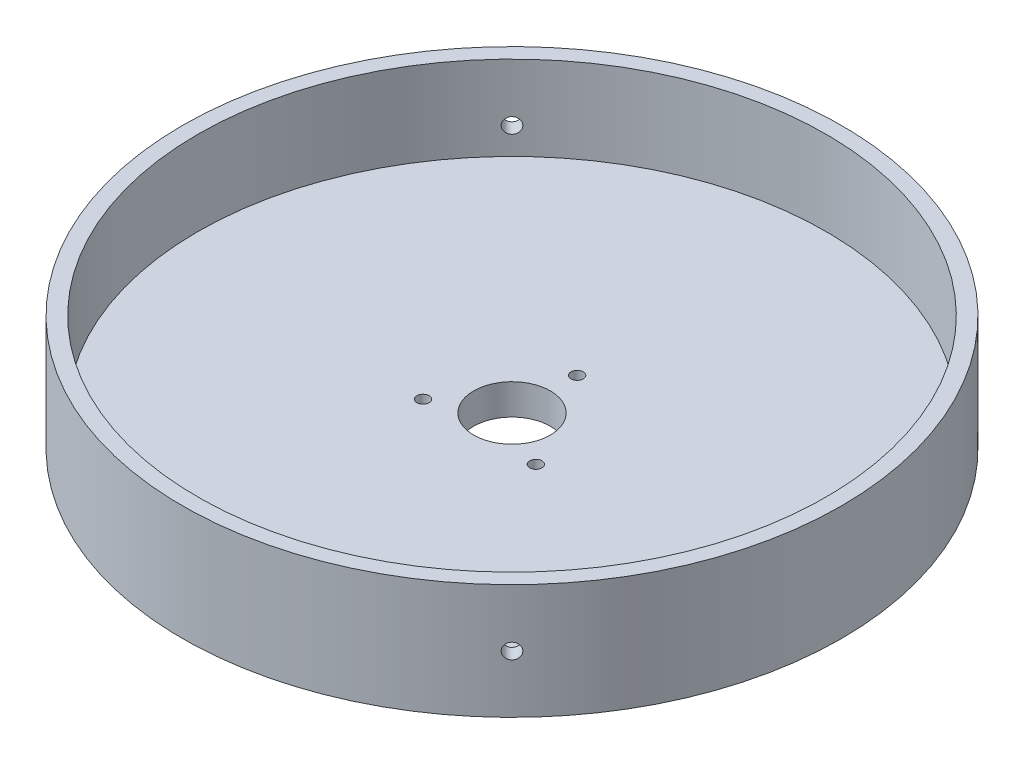
from build123d import *

# Parameters (mm, degrees)
SKETCH2_R          = 0.8
CUT_EXTRUDE1_DEPTH = 62.798058222
SKETCH3_R          = 1
CUT_EXTRUDE2_DEPTH = 63.633856659
CIRPATTERN1_COUNT  = 4


with BuildPart() as part:
    # Sketch1 → Revolve1 (revolve)
    with BuildSketch(Plane.XY, mode=Mode.PRIVATE) as revolve1_sk:
        Polygon((5, 4), (5, 0), (43, 0), (43, 15), (41, 15), (41, 4), align=None)
    revolve(revolve1_sk.sketch.rotate(Axis((0, 4, 0), (0, -1, 0)), 180), axis=Axis((0, 4, 0), (0, -1, 0)))

    # Sketch2 → Cut-Extrude1 (cut, through all)
    with BuildSketch(Plane(origin=(0, 4, 0), x_dir=(1, 0, 0), z_dir=(0, 1, 0))):
        with Locations(Location((0, 8.5, 0), (0, 0, 180))):
            Circle(SKETCH2_R)
        with Locations(Location((7.361215932, -4.25, 0), (0, 0, 180))):
            Circle(SKETCH2_R)
        with Locations(Location((-7.361215932, -4.25, 0), (0, 0, 180))):
            Circle(SKETCH2_R)
    extrude(amount=-CUT_EXTRUDE1_DEPTH, mode=Mode.SUBTRACT)

    # Sketch3 → Cut-Extrude2 (cut, through all)
    with BuildSketch(Plane(origin=(0, 0, 0), x_dir=(0.7071067811865464, 0, 0.7071067811865488), z_dir=(-0.7071067811865488, 0, 0.7071067811865464))):
        with Locations((0, 7.5)):
            Circle(SKETCH3_R)
    cut_extrude2 = extrude(amount=-CUT_EXTRUDE2_DEPTH, mode=Mode.SUBTRACT)

    # CirPattern1: Cut-Extrude2 ×4 about axis
    cirpattern1_axis = Axis((0, 4, 0), (0, 1, 0))
    for i in range(1, CIRPATTERN1_COUNT):
        add(cut_extrude2.rotate(cirpattern1_axis, i * 360 / CIRPATTERN1_COUNT), mode=Mode.SUBTRACT)


solid = part.part
